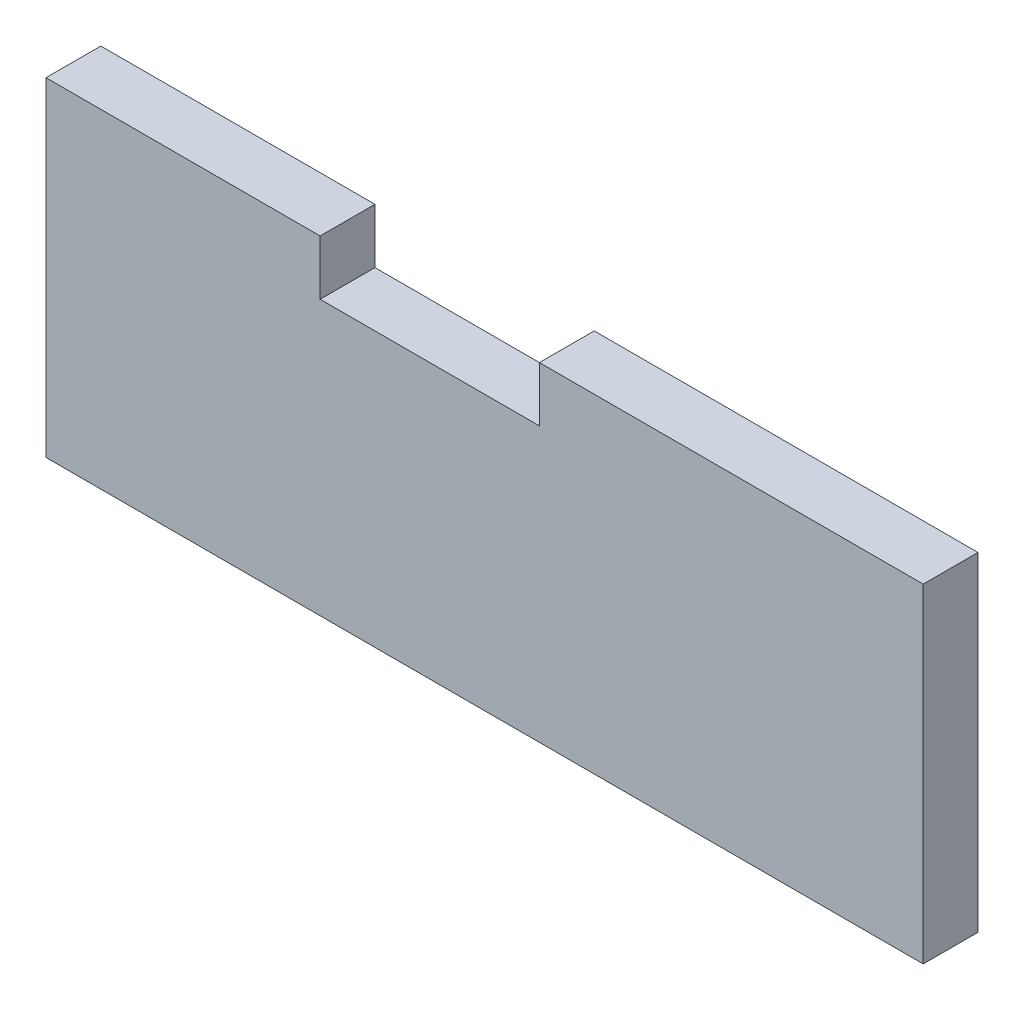
from build123d import *

# Parameters (mm, degrees)
SKETCH_1_W          = 80
SKETCH_1_H          = 30
EXTRUDE_1_DEPTH     = 5
SKETCH_2_W          = 20
SKETCH_2_H          = 5
CUT_EXTRUDE_1_DEPTH = 10


with BuildPart() as part:
    # 草图1 → 凸台-拉伸1 (new body)
    with BuildSketch(Plane.XY):
        Rectangle(SKETCH_1_W, SKETCH_1_H)
    extrude(amount=EXTRUDE_1_DEPTH)

    # 草图2 → 切除-拉伸1 (cut)
    with BuildSketch(Plane(origin=(0, 0, 0), x_dir=(-1, 0, 0), z_dir=(0, 0, -1))):
        with Locations((5, 12.5)):
            Rectangle(SKETCH_2_W, SKETCH_2_H)
    extrude(amount=-CUT_EXTRUDE_1_DEPTH, mode=Mode.SUBTRACT)


solid = part.part
